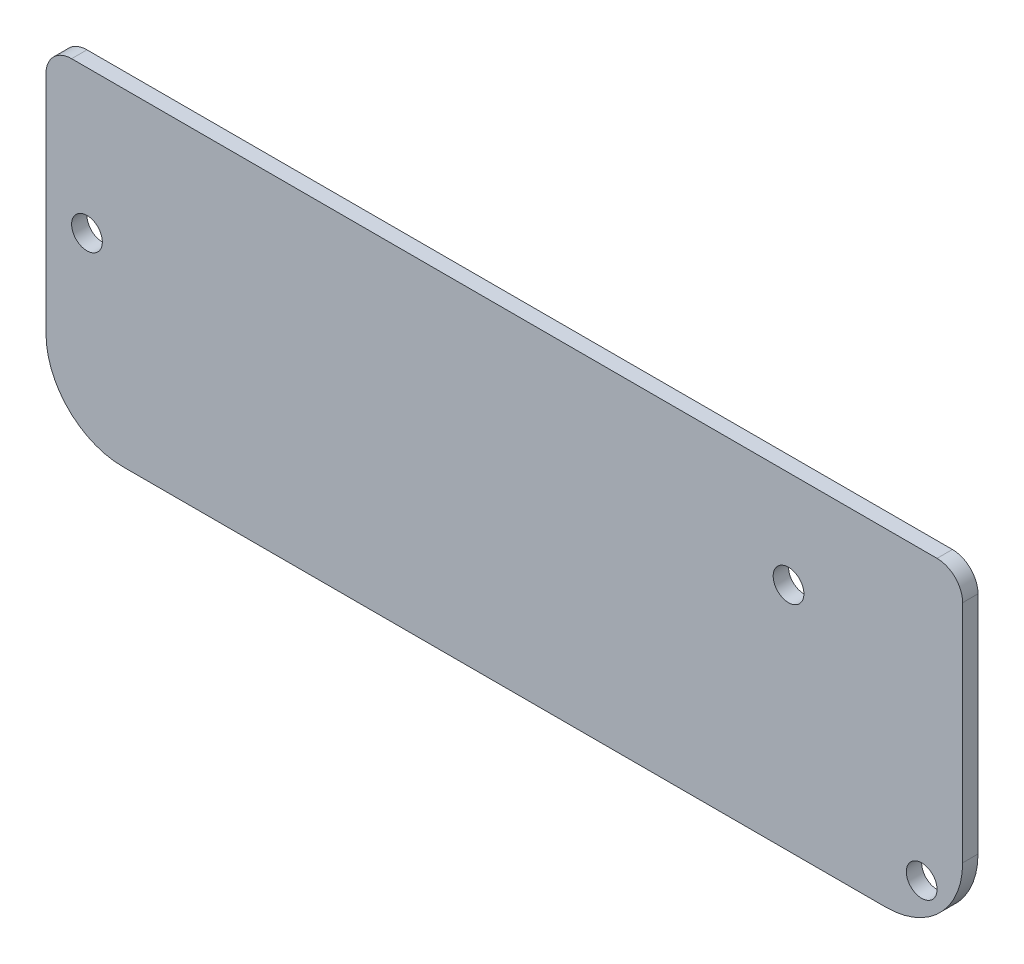
from build123d import *

# Parameters (mm, degrees)
BOSS_EXTRU_1_DEPTH      = 3
ESQUISSE2_R             = 3
ENL_V_MAT_EXTRU_1_DEPTH = 3


with BuildPart() as part:
    # Esquisse1 → Boss.-Extru.1 (new body)
    with BuildSketch(Plane.XY):
        with BuildLine():
            Line((118.101682981, 78.632253408), (267.101682981, 78.632253408))
            ThreePointArc((267.101682981, 78.632253408), (277.708284699, 83.025651691), (282.101682981, 93.632253408))
            Line((282.101682981, 93.632253408), (282.101682981, 137.632253408))
            ThreePointArc((282.101682981, 137.632253408), (280.637216887, 141.167787314), (277.101682981, 142.632253408))
            Line((277.101682981, 142.632253408), (108.101682981, 142.632253408))
            ThreePointArc((108.101682981, 142.632253408), (104.566149075, 141.167787314), (103.101682981, 137.632253408))
            Line((103.101682981, 137.632253408), (103.101682981, 93.632253408))
            ThreePointArc((103.101682981, 93.632253408), (107.495081263, 83.025651691), (118.101682981, 78.632253408))
        make_face()
    extrude(amount=BOSS_EXTRU_1_DEPTH)

    # Esquisse2 → Enlèv. mat.-Extru.1 (cut)
    with BuildSketch(Plane(origin=(0, 0, 0), x_dir=(-1, 0, 0), z_dir=(0, 0, -1))):
        with Locations((-111.101682981, 114.632253408)):
            Circle(ESQUISSE2_R)
        with Locations((-248.101682981, 123.632253408)):
            Circle(ESQUISSE2_R)
        with Locations((-274.101682981, 86.632253408)):
            Circle(ESQUISSE2_R)
    extrude(amount=-ENL_V_MAT_EXTRU_1_DEPTH, mode=Mode.SUBTRACT)


solid = part.part
